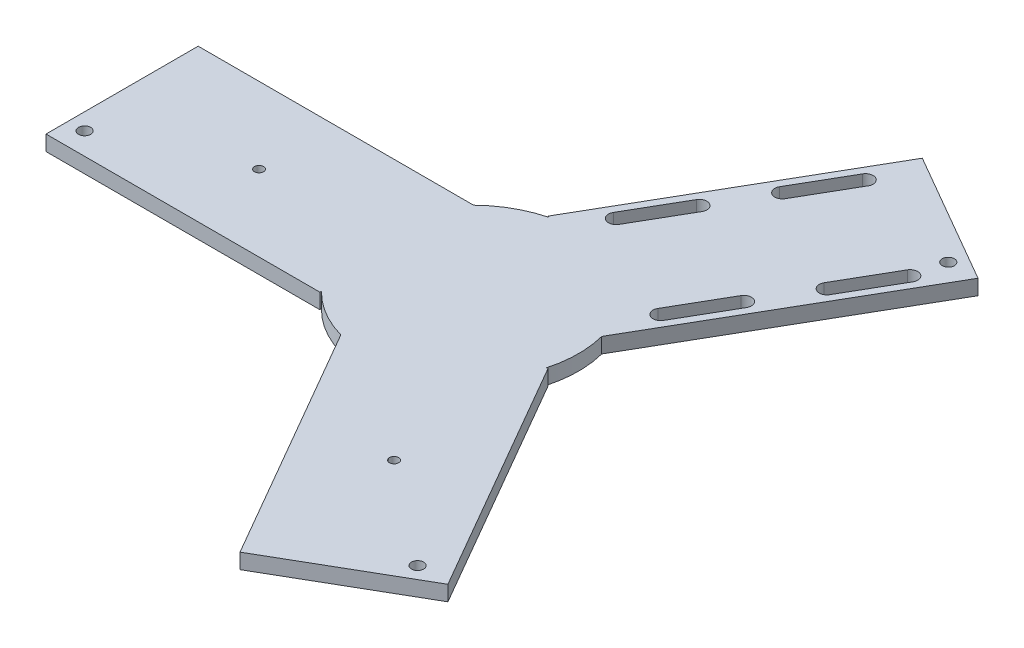
from build123d import *

# Parameters (mm, degrees)
ESQUISSE3_R             = 35
BOSS_EXTRU_3_DEPTH      = 5
ESQUISSE5_R             = 1.5
ENL_V_MAT_EXTRU_1_DEPTH = 161.669919512
ESQUISSE7_R             = 2
ENL_V_MAT_EXTRU_2_DEPTH = 10


with BuildPart() as part:
    # Esquisse3 → Boss.-Extru.3 (new body)
    with BuildSketch(Plane(origin=(0, 0, 0), x_dir=(1, 0, 0), z_dir=(0, 1, 0))):
        with BuildLine():
            Line((-115, -25), (-25, -25))
            Line((-25, -25), (-24.99494949, -24.500051021))
            ThreePointArc((-24.99494949, -24.500051021), (-34.998214236, 0.353553761), (-24.494897428, 25))
            Line((-24.494897428, 25), (-25, 25))
            Line((-25, 25), (-115, 25))
            Line((-115, 25), (-115, -25))
        make_face()
        Circle(ESQUISSE3_R)
        Polygon((-9.403186381, -33.713203436), (35.849364905, -112.092921435), (79.150635095, -87.092921435), (34.150635095, -9.150635095), align=None)
        with BuildLine():
            Line((-24.494897428, 25), (-24.99494949, -24.500051021))
            ThreePointArc((-24.99494949, -24.500051021), (-17.805293657, -30.132565736), (-9.403186381, -33.713203436))
            Line((-9.403186381, -33.713203436), (33.715141323, -9.396235714))
            ThreePointArc((33.715141323, -9.396235714), (34.677297662, -4.741837919), (35, 0))
            ThreePointArc((35, 0), (34.72342821, 4.391302011), (33.898083809, 8.713203436))
            Line((33.898083809, 8.713203436), (-8.720191833, 33.896286735))
            ThreePointArc((-8.720191833, 33.896286735), (-17.19292058, 30.486119496), (-24.494897428, 25))
        make_face()
        Circle(ESQUISSE3_R)
        Polygon((33.898083809, 8.713203436), (79.150635095, 87.092921435), (35.849364905, 112.092921435), (-9.150635095, 34.150635095), align=None)
        with BuildLine():
            ThreePointArc((33.898083809, 8.713203436), (17.805293657, 30.132565736), (-8.720191833, 33.896286735))
            Line((-8.720191833, 33.896286735), (33.898083809, 8.713203436))
        make_face()
    extrude(amount=BOSS_EXTRU_3_DEPTH)

    # Esquisse5 → Enlèv. mat.-Extru.1 (cut, through all)
    with BuildSketch(Plane(origin=(0, 5, 0), x_dir=(1, 0, 0), z_dir=(0, 1, 0))):
        with BuildLine():
            Line((30.514428415, 97.852540378), (20.514428415, 80.532032303))
            ThreePointArc((20.514428415, 80.532032303), (21.429491924, 77.116968793), (24.844555434, 78.032032303))
            Line((24.844555434, 78.032032303), (34.844555434, 95.352540378))
            ThreePointArc((34.844555434, 95.352540378), (33.929491924, 98.767603888), (30.514428415, 97.852540378))
        make_face()
        with BuildLine():
            ThreePointArc((10.514428415, 63.211524227), (13.929491924, 64.126587737), (14.844555434, 60.711524227))
            Line((14.844555434, 60.711524227), (4.844555434, 43.391016151))
            ThreePointArc((4.844555434, 43.391016151), (1.429491924, 42.475952642), (0.514428415, 45.891016151))
            Line((0.514428415, 45.891016151), (10.514428415, 63.211524227))
        make_face()
        with BuildLine():
            ThreePointArc((65.155444566, 77.852540378), (68.570508076, 78.767603888), (69.485571585, 75.352540378))
            Line((69.485571585, 75.352540378), (59.485571585, 58.032032303))
            ThreePointArc((59.485571585, 58.032032303), (56.070508076, 57.116968793), (55.155444566, 60.532032303))
            Line((55.155444566, 60.532032303), (65.155444566, 77.852540378))
        make_face()
        with BuildLine():
            Line((45.155444566, 43.211524227), (35.155444566, 25.891016151))
            ThreePointArc((35.155444566, 25.891016151), (36.070508076, 22.475952642), (39.485571585, 23.391016151))
            Line((39.485571585, 23.391016151), (49.485571585, 40.711524227))
            ThreePointArc((49.485571585, 40.711524227), (48.570508076, 44.126587737), (45.155444566, 43.211524227))
        make_face()
        with Locations(Location((35, -60.621778265, 0), (0, 0, 270))):
            Circle(ESQUISSE5_R)
        with Locations(Location((-70, 0, 0), (0, 0, 270))):
            Circle(ESQUISSE5_R)
    extrude(amount=-ENL_V_MAT_EXTRU_1_DEPTH, mode=Mode.SUBTRACT)

    # Esquisse7 → Enlèv. mat.-Extru.2 (cut)
    with BuildSketch(Plane(origin=(0, 5, 0), x_dir=(1, 0, 0), z_dir=(0, 1, 0))):
        with Locations(Location((69.722431864, 86.762794416, 0), (0, 0, 270))):
            Circle(ESQUISSE7_R)
        with Locations(Location((-109.562568341, -17.757653858, 0), (0, 0, 270))):
            Circle(ESQUISSE7_R)
        with Locations(Location((68.847568546, -86.762794416, 0), (0, 0, 270))):
            Circle(ESQUISSE7_R)
    extrude(amount=-ENL_V_MAT_EXTRU_2_DEPTH, mode=Mode.SUBTRACT)


solid = part.part
